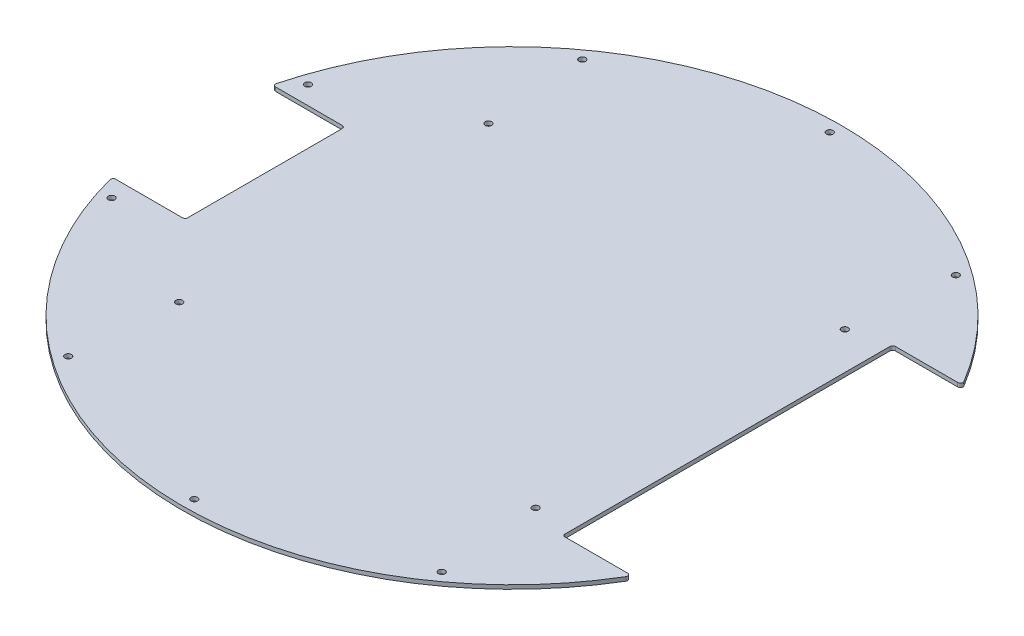
from build123d import *

# Parameters (mm, degrees)
SKETCH1_R           = 251.5
BOSS_EXTRUDE1_DEPTH = 3
SKETCH2_R           = 2.5
CUT_EXTRUDE1_DEPTH  = 5
SKETCH4_R           = 2.5
CUT_EXTRUDE3_DEPTH  = 5
SKETCH5_W           = 73.96870399
SKETCH5_H           = 122
SKETCH5_W_2         = 122.237238898
SKETCH5_H_2         = 252
CUT_EXTRUDE4_DEPTH  = 10
FILLET1_R           = 2


with BuildPart() as part:
    # Sketch1 → Boss-Extrude1 (new body)
    with BuildSketch(Plane(origin=(0, 0, 0), x_dir=(1, 0, 0), z_dir=(0, 1, 0))):
        with Locations(Location((0, 0, 0), (0, 0, 270))):
            Circle(SKETCH1_R)
    extrude(amount=BOSS_EXTRUDE1_DEPTH)

    # Sketch2 → Cut-Extrude1 (cut)
    with BuildSketch(Plane(origin=(0, 3, 0), x_dir=(1, 0, 0), z_dir=(0, 1, 0))):
        with Locations(Location((-136, 118, 0), (0, 0, 270))):
            Circle(SKETCH2_R)
        with Locations(Location((136, 118, 0), (0, 0, 270))):
            Circle(SKETCH2_R)
        with Locations(Location((136, -118, 0), (0, 0, 270))):
            Circle(SKETCH2_R)
        with Locations(Location((-136, -118, 0), (0, 0, 270))):
            Circle(SKETCH2_R)
    extrude(amount=-CUT_EXTRUDE1_DEPTH, mode=Mode.SUBTRACT)

    # Sketch4 → Cut-Extrude3 (cut)
    with BuildSketch(Plane(origin=(0, 3, 0), x_dir=(1, 0, 0), z_dir=(0, 1, 0))):
        with Locations(Location((0, 242.5, 0), (0, 0, 270))):
            Circle(SKETCH4_R)
        with Locations(Location((142.537923681, 196.186621136, 0), (0, 0, 270))):
            Circle(SKETCH4_R)
        with Locations(Location((230.631205202, 74.936621136, 0), (0, 0, 270))):
            Circle(SKETCH4_R)
        with Locations(Location((230.631205202, -74.936621136, 0), (0, 0, 270))):
            Circle(SKETCH4_R)
        with Locations(Location((142.537923681, -196.186621136, 0), (0, 0, 270))):
            Circle(SKETCH4_R)
        with Locations(Location((0, -242.5, 0), (0, 0, 270))):
            Circle(SKETCH4_R)
        with Locations(Location((-142.537923681, -196.186621136, 0), (0, 0, 270))):
            Circle(SKETCH4_R)
        with Locations(Location((-230.631205202, -74.936621136, 0), (0, 0, 270))):
            Circle(SKETCH4_R)
        with Locations(Location((-230.631205202, 74.936621136, 0), (0, 0, 270))):
            Circle(SKETCH4_R)
        with Locations(Location((-142.537923681, 196.186621136, 0), (0, 0, 270))):
            Circle(SKETCH4_R)
    extrude(amount=-CUT_EXTRUDE3_DEPTH, mode=Mode.SUBTRACT)

    # Sketch5 → Cut-Extrude4 (cut)
    with BuildSketch(Plane(origin=(0, 3, 0), x_dir=(1, 0, 0), z_dir=(0, 1, 0))):
        with Locations((-225.484351995, 0)):
            Rectangle(SKETCH5_W, SKETCH5_H)
        with Locations((225.618619449, 0)):
            Rectangle(SKETCH5_W_2, SKETCH5_H_2)
    extrude(amount=-CUT_EXTRUDE4_DEPTH, mode=Mode.SUBTRACT)

    # Fillet1
    fillet1_edges = [part.edges().sort_by_distance(p)[0] for p in [
        (-188.5, 1.5, -61),
        (-243.990266199, 1.5, 61),
        (-188.5, 1.5, 61),
        (-243.990266199, 1.5, -61),
        (164.5, 1.5, 126),
        (217.660860055, 1.5, -126),
        (164.5, 1.5, -126),
        (217.660860055, 1.5, 126),
    ]]
    fillet(fillet1_edges, radius=FILLET1_R)


solid = part.part
